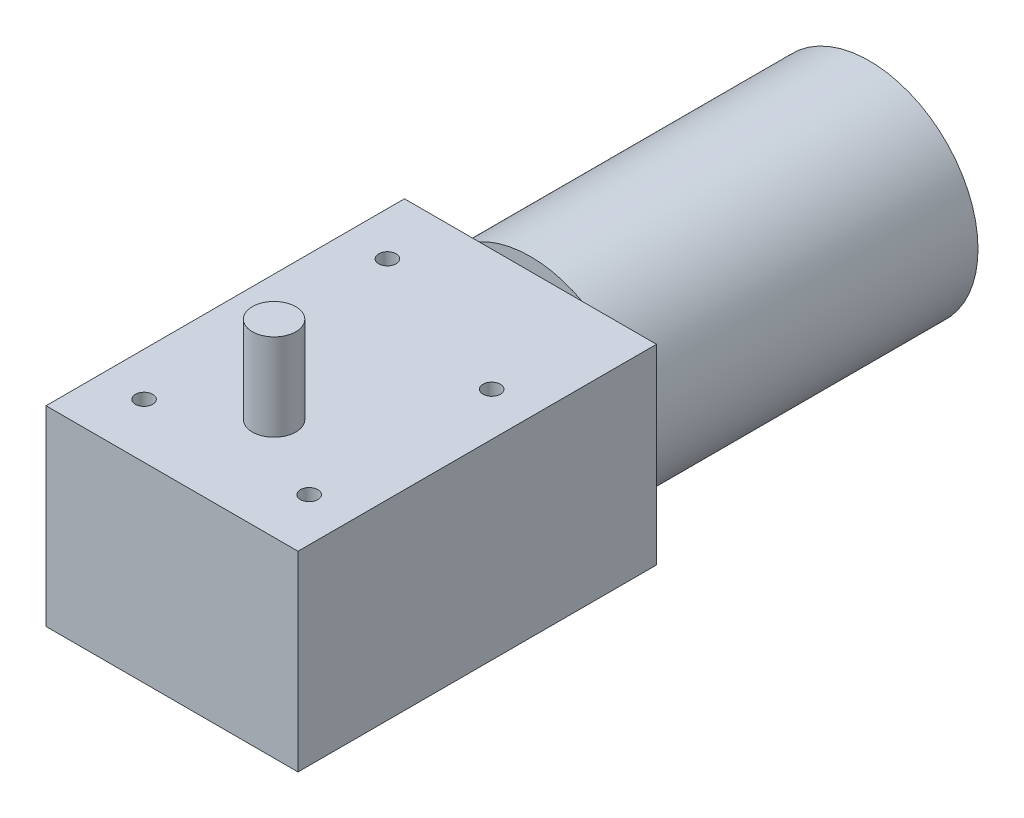
from build123d import *

# Parameters (mm, degrees)
SKETCH1_R           = 25
BOSS_EXTRUDE1_DEPTH = 78
SKETCH2_W           = 58
SKETCH2_H           = 44
BOSS_EXTRUDE2_DEPTH = 82.5
SKETCH3_R           = 5
BOSS_EXTRUDE3_DEPTH = 20
SKETCH4_R           = 2
CUT_EXTRUDE1_DEPTH  = 170.73582415


with BuildPart() as part:
    # Sketch1 → Boss-Extrude1 (new body)
    with BuildSketch(Plane.XY):
        Circle(SKETCH1_R)
    extrude(amount=BOSS_EXTRUDE1_DEPTH)

    # Sketch2 → Boss-Extrude2 (add)
    with BuildSketch(Plane.XY.offset(78)):
        Rectangle(SKETCH2_W, SKETCH2_H)
    extrude(amount=BOSS_EXTRUDE2_DEPTH)

    # Sketch3 → Boss-Extrude3 (add)
    with BuildSketch(Plane(origin=(0, 22, 0), x_dir=(1, 0, 0), z_dir=(0, 1, 0))):
        with Locations(Location((0, -137, 0), (0, 0, 270))):
            Circle(SKETCH3_R)
    extrude(amount=BOSS_EXTRUDE3_DEPTH)

    # Sketch4 → Cut-Extrude1 (cut, through all)
    with BuildSketch(Plane(origin=(0, 22, 0), x_dir=(1, 0, 0), z_dir=(0, 1, 0))):
        with Locations(Location((19, -147.94, 0), (0, 0, 270))):
            Circle(SKETCH4_R)
        with Locations(Location((19, -105.92, 0), (0, 0, 270))):
            Circle(SKETCH4_R)
        with Locations(Location((-19, -147.94, 0), (0, 0, 270))):
            Circle(SKETCH4_R)
        with Locations(Location((-19, -91.93, 0), (0, 0, 270))):
            Circle(SKETCH4_R)
    extrude(amount=-CUT_EXTRUDE1_DEPTH, mode=Mode.SUBTRACT)


solid = part.part
